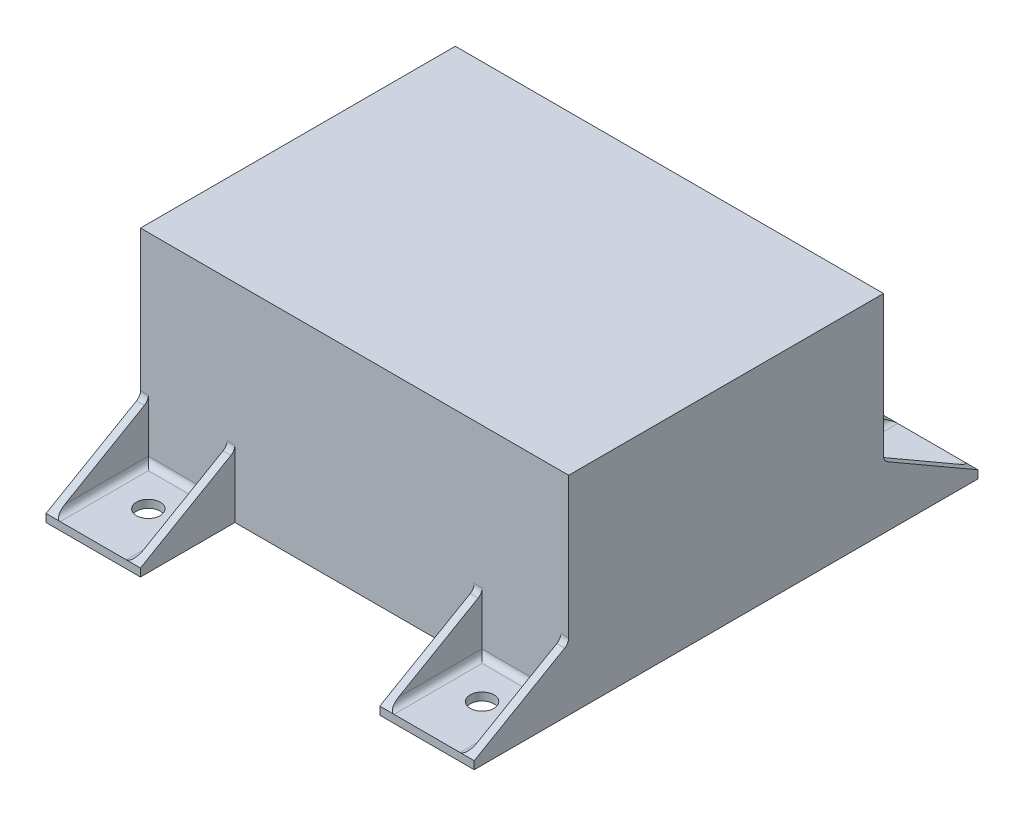
from build123d import *

# Parameters (mm, degrees)
SKETCH1_W                    = 172.72
SKETCH1_H                    = 127
BOSS_EXTRUDE1_DEPTH          = 83.82
SHELL1_T                     = -3.175
SKETCH6_W                    = 38.1
SKETCH6_H                    = 38.1
BOSS_EXTRUDE4_DEPTH          = 3.175
BOSS_EXTRUDE5_DEPTH          = 3.175
MIRROR5_COPY_1_DEPTH         = 3.175
MIRROR6_COPY_1_DEPTH         = 3.175
MIRROR6_COPY_2_SKETCH_W      = 38.1
MIRROR6_COPY_2_SKETCH_H      = 38.1
MIRROR6_COPY_2_DEPTH         = 3.175
MIRROR6_COPY_3_DEPTH         = 3.175
MIRROR6_COPY_4_DEPTH         = 3.175
FILLET3_R                    = 2.54
F_3_8_0_375_DIAMETER_HOLE1_D = 9.525
MIRROR8_COPY_1_D             = 9.525
FILLET4_R                    = 3.175


with BuildPart() as part:
    # Sketch1 → Boss-Extrude1 (new body)
    with BuildSketch(Plane(origin=(0, 0, 0), x_dir=(1, 0, 0), z_dir=(0, 1, 0))):
        Rectangle(SKETCH1_W, SKETCH1_H)
    extrude(amount=BOSS_EXTRUDE1_DEPTH)

    # Shell1
    shell1_openings = [part.faces().sort_by_distance(p)[0] for p in [
        (0, 0, 0),
    ]]
    offset(amount=SHELL1_T, openings=shell1_openings, kind=Kind.INTERSECTION)

    # Sketch6 → Boss-Extrude4 (add)
    with BuildSketch(Plane.XZ):
        with Locations((-67.31, 82.55)):
            Rectangle(SKETCH6_W, SKETCH6_H)
    boss_extrude4 = extrude(amount=-BOSS_EXTRUDE4_DEPTH)

    # Sketch7 → Boss-Extrude5 (add)
    with BuildSketch(Plane.ZY.offset(86.36)):
        Polygon((101.6, 3.175), (63.5, 25.172045256), (63.5, 3.175), align=None)
    boss_extrude5 = extrude(amount=-BOSS_EXTRUDE5_DEPTH)

    # Mirror4: Boss-Extrude5 across plane
    add(boss_extrude5.mirror(Plane.ZY.offset(67.31)))

    # Mirror5: Boss-Extrude4, Boss-Extrude5 across plane
    add(boss_extrude4.mirror(Plane.XY))
    add(boss_extrude5.mirror(Plane.XY))

    # Mirror5 copy 1 sketch → Mirror5 copy 1 (add)
    with BuildSketch(Plane(origin=(-48.26, 0, 0), x_dir=(0, 0, -1), z_dir=(1, 0, 0))):
        Polygon((101.6, 3.175), (63.5, 25.172045256), (63.5, 3.175), align=None)
    extrude(amount=-MIRROR5_COPY_1_DEPTH)

    # Mirror6: Boss-Extrude4, Boss-Extrude5 across plane
    add(boss_extrude4.mirror(Plane(origin=(0, 0, 0), x_dir=(0, 0, 1), z_dir=(1, 0, 0))))
    add(boss_extrude5.mirror(Plane(origin=(0, 0, 0), x_dir=(0, 0, 1), z_dir=(1, 0, 0))))

    # Mirror6 copy 1 sketch → Mirror6 copy 1 (add)
    with BuildSketch(Plane.ZY.offset(-48.26)):
        Polygon((101.6, 3.175), (63.5, 25.172045256), (63.5, 3.175), align=None)
    extrude(amount=-MIRROR6_COPY_1_DEPTH)

    # Mirror6 copy 2 sketch → Mirror6 copy 2 (add)
    with BuildSketch(Plane(origin=(0, 0, 0), x_dir=(-1, 0, 0), z_dir=(0, -1, 0))):
        with Locations((-67.31, 82.55)):
            Rectangle(MIRROR6_COPY_2_SKETCH_W, MIRROR6_COPY_2_SKETCH_H)
    extrude(amount=-MIRROR6_COPY_2_DEPTH)

    # Mirror6 copy 3 sketch → Mirror6 copy 3 (add)
    with BuildSketch(Plane(origin=(86.36, 0, 0), x_dir=(0, 0, -1), z_dir=(1, 0, 0))):
        Polygon((101.6, 3.175), (63.5, 25.172045256), (63.5, 3.175), align=None)
    extrude(amount=-MIRROR6_COPY_3_DEPTH)

    # Mirror6 copy 4 sketch → Mirror6 copy 4 (add)
    with BuildSketch(Plane(origin=(48.26, 0, 0), x_dir=(0, 0, -1), z_dir=(-1, 0, 0))):
        Polygon((101.6, -3.175), (63.5, -25.172045256), (63.5, -3.175), align=None)
    extrude(amount=-MIRROR6_COPY_4_DEPTH)

    # Fillet3
    fillet3_edges = [part.edges().sort_by_distance(p)[0] for p in [
        (51.435, 3.175, -82.55),
        (67.31, 3.175, -63.5),
        (83.185, 3.175, -82.55),
        (51.435, 3.175, 82.55),
        (67.31, 3.175, 63.5),
        (83.185, 3.175, 82.55),
        (-67.31, 3.175, 63.5),
        (-83.185, 3.175, 82.55),
        (-51.435, 3.175, 82.55),
        (-51.435, 3.175, -82.55),
        (-67.31, 3.175, -63.5),
        (-83.185, 3.175, -82.55),
    ]]
    fillet(fillet3_edges, radius=FILLET3_R)

    # 3/8 (0.375) Diameter Hole1 (through all)
    with Locations(Plane(origin=(0, 3.175, 0), x_dir=(1, 0, 0), z_dir=(0, 1, 0))):
        with Locations((-67.31, -79.375)):
            f_3_8_0_375_diameter_hole1 = Hole(F_3_8_0_375_DIAMETER_HOLE1_D / 2)

    # Mirror7: 3/8 (0.375) Diameter Hole1 across plane
    add(f_3_8_0_375_diameter_hole1.mirror(Plane.XY), mode=Mode.SUBTRACT)

    # Mirror8: 3/8 (0.375) Diameter Hole1 across plane
    add(f_3_8_0_375_diameter_hole1.mirror(Plane(origin=(0, 0, 0), x_dir=(0, 0, 1), z_dir=(1, 0, 0))), mode=Mode.SUBTRACT)

    # Mirror8 copy 1 (through all)
    with Locations(Plane(origin=(0, 3.175, 0), x_dir=(-1, 0, 0), z_dir=(0, 1, 0))):
        with Locations((-67.31, -79.375)):
            Hole(MIRROR8_COPY_1_D / 2)

    # Fillet4
    fillet4_edges = [part.edges().sort_by_distance(p)[0] for p in [
        (49.8475, 25.172045256, -63.5),
        (84.7725, 25.172045256, -63.5),
        (49.8475, 25.172045256, 63.5),
        (84.7725, 25.172045256, 63.5),
        (-84.7725, 25.172045256, 63.5),
        (-49.8475, 25.172045256, 63.5),
        (-49.8475, 25.172045256, -63.5),
        (-84.7725, 25.172045256, -63.5),
    ]]
    fillet(fillet4_edges, radius=FILLET4_R)


solid = part.part
